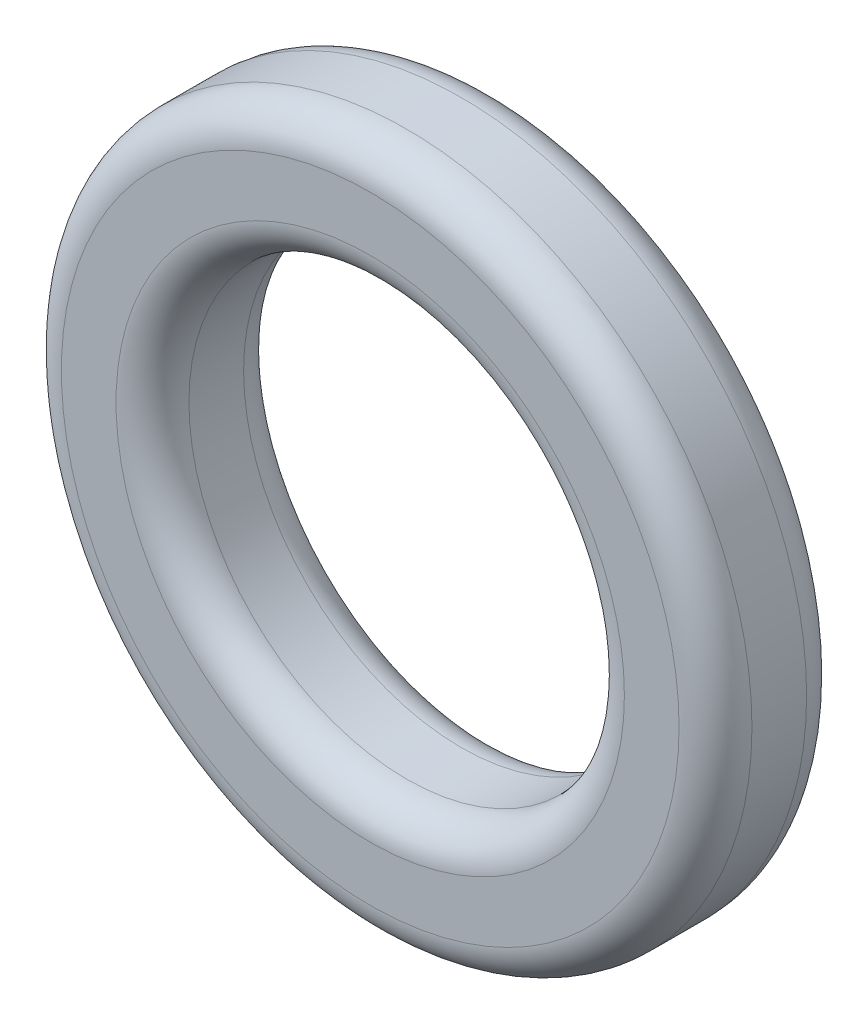
from build123d import *

# Parameters (mm, degrees)
SKETCH2_R           = 4.8133
SKETCH2_R_2         = 3.0353
BOSS_EXTRUDE1_DEPTH = 1.778
FILLET1_R           = 0.508


with BuildPart() as part:
    # Sketch2 → Boss-Extrude1 (new body)
    with BuildSketch(Plane.XY):
        Circle(SKETCH2_R)
        Circle(SKETCH2_R_2, mode=Mode.SUBTRACT)
    extrude(amount=BOSS_EXTRUDE1_DEPTH)

    # Fillet1
    fillet1_edges = [part.edges().sort_by_distance(p)[0] for p in [
        (-4.8133, 0, 0),
        (-4.8133, 0, 1.778),
        (-3.0353, 0, 0),
        (-3.0353, 0, 1.778),
    ]]
    fillet(fillet1_edges, radius=FILLET1_R)


solid = part.part
